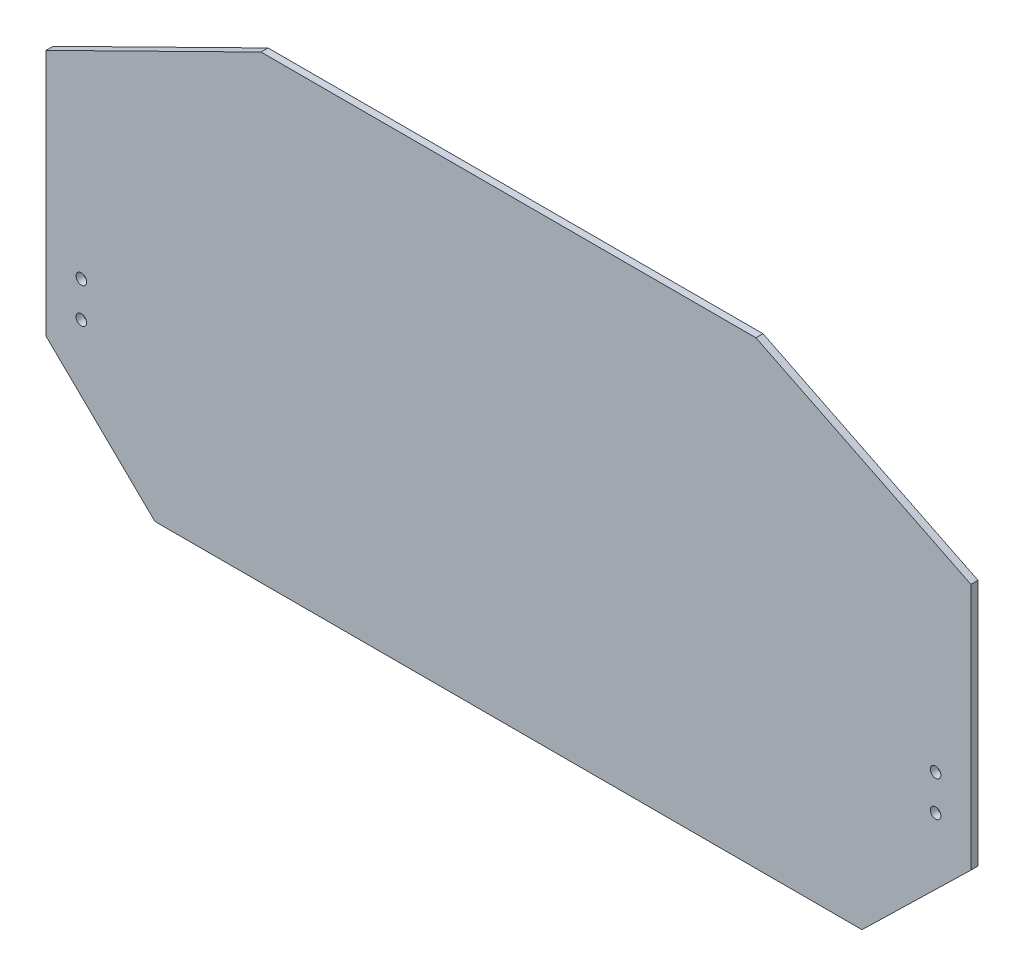
from build123d import *

# Parameters (mm, degrees)
SKETCH_1_R      = 1.5
EXTRUDE_1_DEPTH = 2


with BuildPart() as part:
    # 草图1 → 凸台-拉伸1 (new body)
    with BuildSketch(Plane.XY):
        Polygon((-130.81475452, 0), (-130.81475452, 70), (-70, 100), (70, 100), (130.81475452, 70), (130.81475452, 0), (100, -30), (-100, -30), align=None)
        with Locations((-120.81475452, 9)):
            Circle(SKETCH_1_R, mode=Mode.SUBTRACT)
        with Locations(Location((120.81475452, 9, 0), (0, 0, 180))):
            Circle(SKETCH_1_R, mode=Mode.SUBTRACT)
        with Locations((-120.81475452, 19)):
            Circle(SKETCH_1_R, mode=Mode.SUBTRACT)
        with Locations(Location((120.81475452, 19, 0), (0, 0, 180))):
            Circle(SKETCH_1_R, mode=Mode.SUBTRACT)
    extrude(amount=EXTRUDE_1_DEPTH)


solid = part.part
